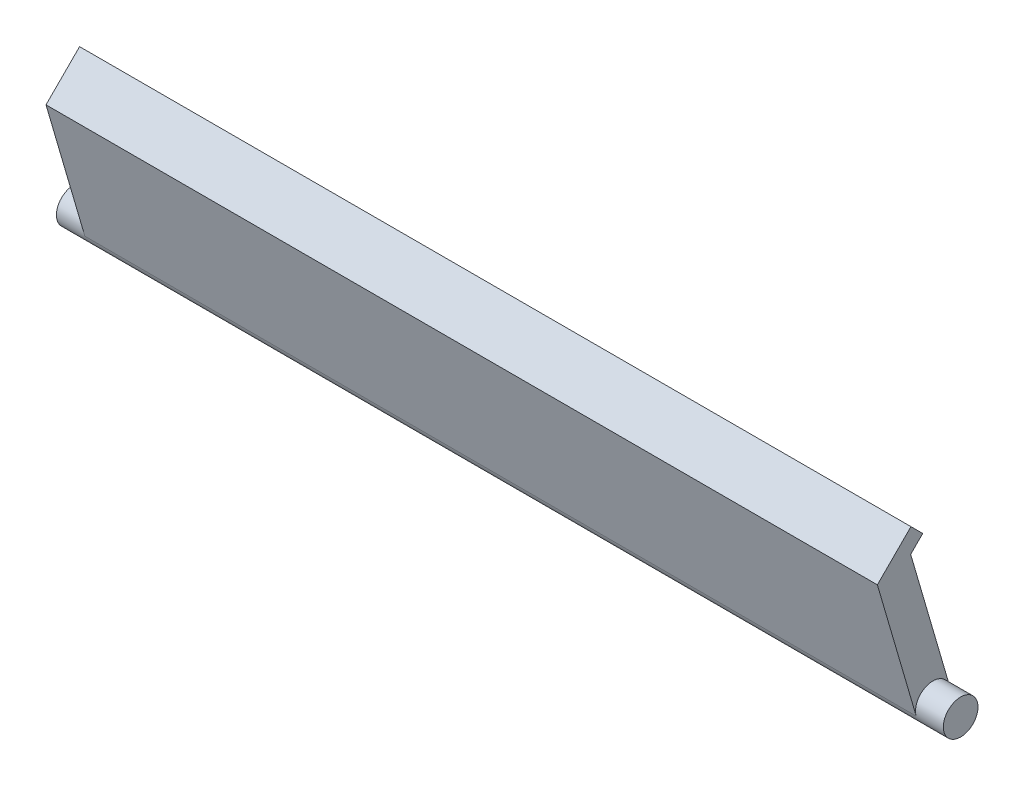
from build123d import *

# Parameters (mm, degrees)
SKETCH1_R                = 25
BOSS_EXTRUDE1_DEPTH      = 1200
BOSS_EXTRUDE2_START      = -1198
BOSS_EXTRUDE2_DEPTH      = 1198
BOSS_EXTRUDE3_DEPTH      = 40
BOSS_EXTRUDE3_DEPTH_BACK = 1238
SKETCH3_R                = 25


with BuildPart() as part:
    # Sketch1 → Boss-Extrude1 (new body)
    with BuildSketch(Plane(origin=(0, 0, 0), x_dir=(0, 0, -1), z_dir=(1, 0, 0))):
        Circle(SKETCH1_R)
    extrude(amount=BOSS_EXTRUDE1_DEPTH)

    # Sketch2 → Boss-Extrude2 (add)
    with BuildSketch(Plane(origin=(1200, 0, 0), x_dir=(0, 0, -1), z_dir=(1, 0, 0)).offset(BOSS_EXTRUDE2_START)):
        with BuildLine():
            Line((23.999631554, 7.001263118), (-32.01047339, 198.998315554))
            Line((-32.01047339, 198.998315554), (-14.618110395, 216.390678549))
            Line((-14.618110395, 216.390678549), (-31.616478831, 233.389046986))
            Line((-31.616478831, 233.389046986), (-80.009736499, 184.995789318))
            Line((-80.009736499, 184.995789318), (-23.999631554, -7.001263118))
            ThreePointArc((-23.999631554, -7.001263118), (-7.001263118, 23.999631554), (23.999631554, 7.001263118))
        make_face()
    extrude(amount=BOSS_EXTRUDE2_DEPTH)

    # Sketch3 → Boss-Extrude3 (add, two sides: drawn at the far end of the back side and taken through both)
    with BuildSketch(Plane(origin=(1200, 0, 0), x_dir=(0, 0, -1), z_dir=(1, 0, 0)).offset(-BOSS_EXTRUDE3_DEPTH_BACK)):
        Circle(SKETCH3_R)
    extrude(amount=BOSS_EXTRUDE3_DEPTH + BOSS_EXTRUDE3_DEPTH_BACK)


solid = part.part
